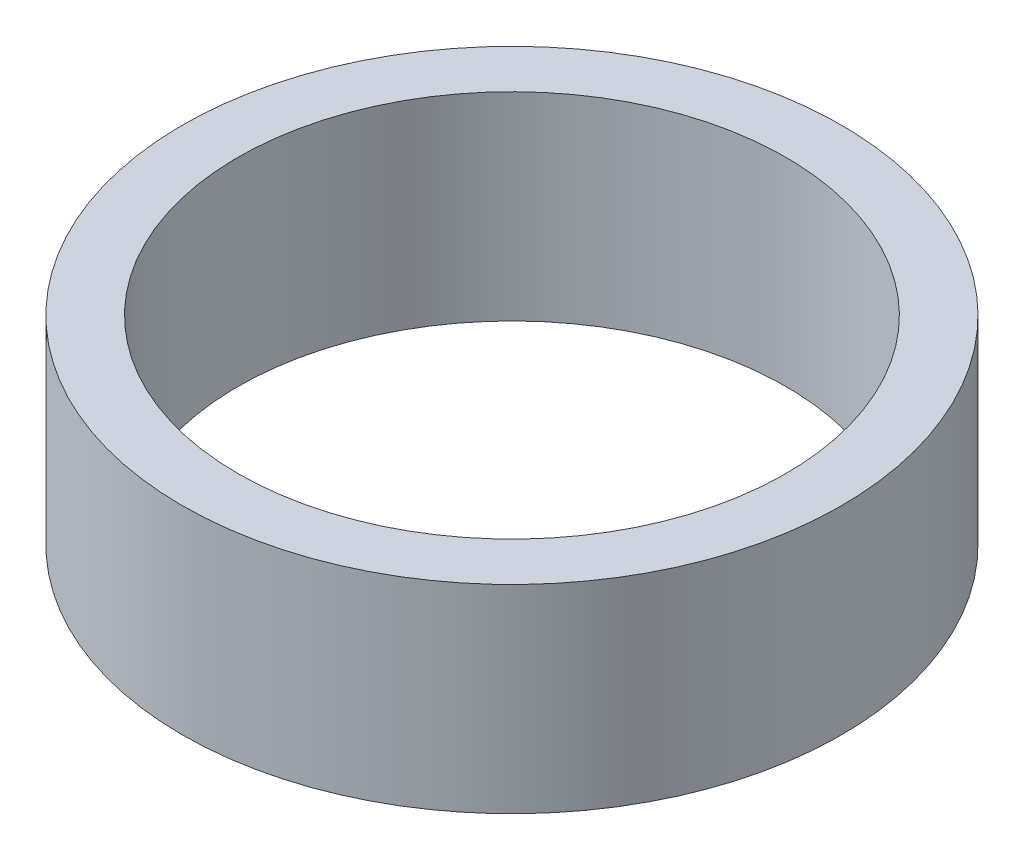
from build123d import *

# Parameters (mm, degrees)
SKETCH1_R           = 21.082
SKETCH1_R_2         = 17.526
BOSS_EXTRUDE1_DEPTH = 12.7


with BuildPart() as part:
    # Sketch1 → Boss-Extrude1 (new body)
    with BuildSketch(Plane(origin=(0, 0, 0), x_dir=(1, 0, 0), z_dir=(0, 1, 0))):
        with Locations(Location((0, 0, 0), (0, 0, 270))):
            Circle(SKETCH1_R)
        with Locations(Location((0, 0, 0), (0, 0, 270))):
            Circle(SKETCH1_R_2, mode=Mode.SUBTRACT)
    extrude(amount=BOSS_EXTRUDE1_DEPTH)


solid = part.part
